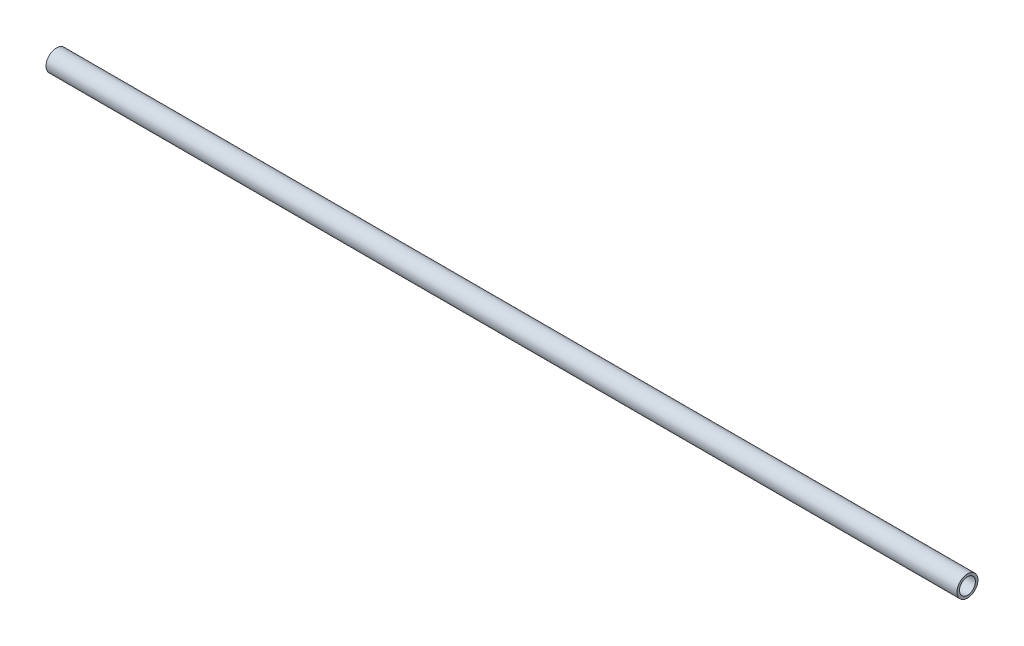
from build123d import *

# Parameters (mm, degrees)
SKETCH1_R           = 12.7
SKETCH1_R_2         = 9.652
BOSS_EXTRUDE1_DEPTH = 1100


with BuildPart() as part:
    # Sketch1 → Boss-Extrude1 (new body)
    with BuildSketch(Plane(origin=(0, 0, 0), x_dir=(0, 0, -1), z_dir=(1, 0, 0))):
        Circle(SKETCH1_R)
        Circle(SKETCH1_R_2, mode=Mode.SUBTRACT)
    extrude(amount=BOSS_EXTRUDE1_DEPTH)


solid = part.part
